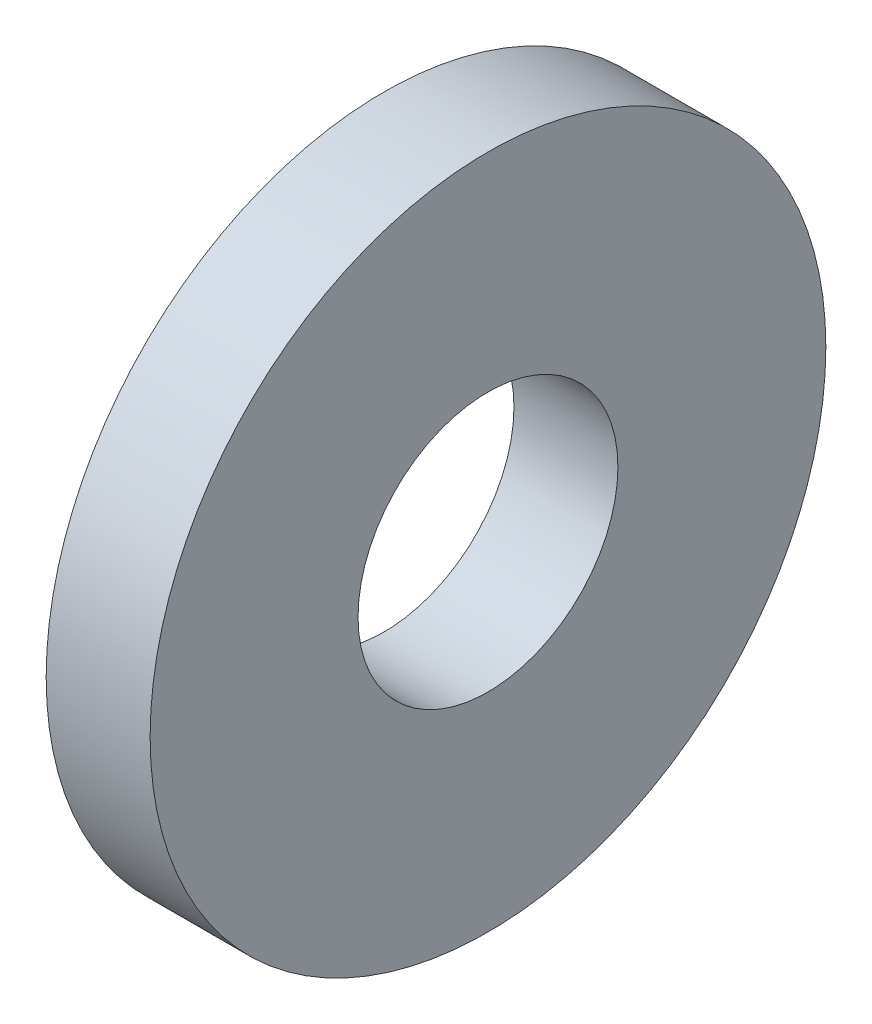
from build123d import *

# Parameters (mm, degrees)
SKETCH1_W = 2
SKETCH1_H = 4


with BuildPart() as part:
    # Sketch1 → Revolve1 (revolve)
    with BuildSketch(Plane(origin=(0, 0, 0), x_dir=(-1, 0, 0), z_dir=(0, 0, -1)), mode=Mode.PRIVATE) as revolve1_sk:
        with Locations((0, 4.5)):
            Rectangle(SKETCH1_W, SKETCH1_H)
    revolve(revolve1_sk.sketch.rotate(Axis((1, 0, 0), (-1, 0, 0)), 270), axis=Axis((1, 0, 0), (-1, 0, 0)))


solid = part.part
